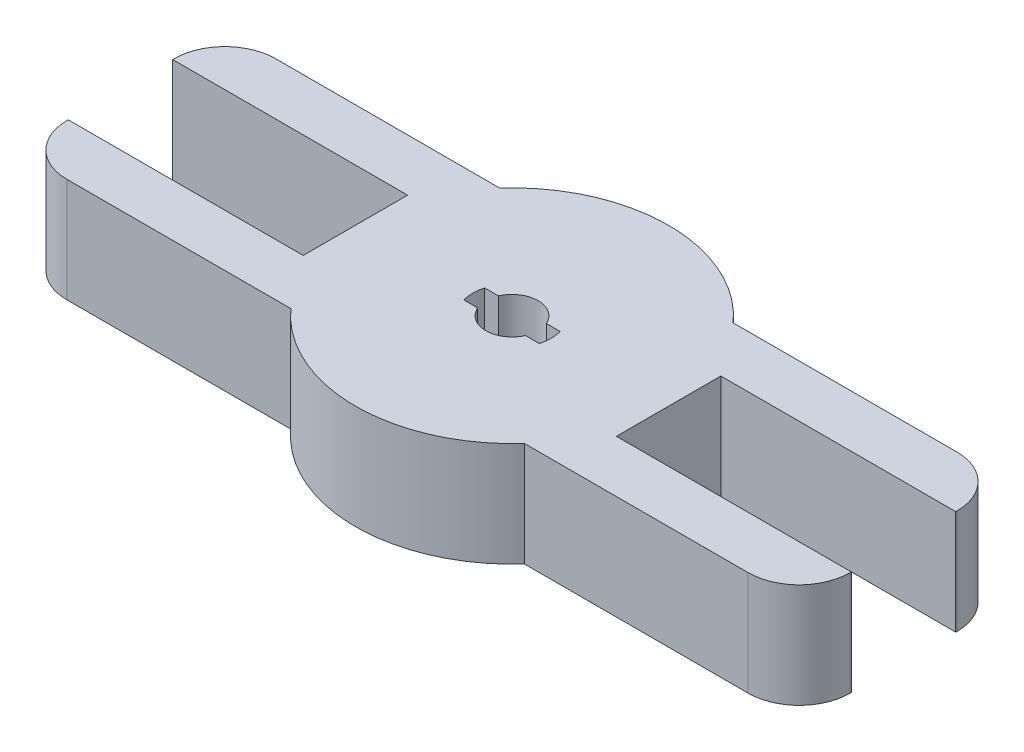
from build123d import *

# Parameters (mm, degrees)
BOSS_EXTRUDE1_DEPTH  = 20
SKETCH2_W            = 45
SKETCH2_H            = 20
CUT_EXTRUDE1_DEPTH   = 20
FILLET1_R            = 9.75
FILLET1_OF_MIRROR4_R = 9.75


with BuildPart() as part:
    # Sketch1 → Boss-Extrude1 (new body)
    with BuildSketch(Plane(origin=(0, 0, 0), x_dir=(1, 0, 0), z_dir=(0, 1, 0))):
        with BuildLine():
            Line((22.360679775, 20), (75, 20))
            Line((75, 20), (75, -20))
            Line((75, -20), (22.360679775, -20))
            ThreePointArc((22.360679775, -20), (12.247448714, -27.386127875), (0, -30))
            Line((0, -30), (0, -20))
            Line((0, -20), (0, 20))
            Line((0, 20), (0, 30))
            ThreePointArc((0, 30), (12.247448714, 27.386127875), (22.360679775, 20))
        make_face()
    boss_extrude1 = extrude(amount=BOSS_EXTRUDE1_DEPTH)

    # Sketch2 → Cut-Extrude1 (cut)
    with BuildSketch(Plane(origin=(0, 20, 0), x_dir=(1, 0, 0), z_dir=(0, 1, 0))):
        with BuildLine():
            Line((0, 5), (0, -5))
            ThreePointArc((0, -5), (2.738612788, -4.183300133), (4.582575695, -2))
            Line((4.582575695, -2), (7.228416147, -2))
            ThreePointArc((7.228416147, -2), (7.5, 0), (7.228416147, 2))
            Line((7.228416147, 2), (4.582575695, 2))
            ThreePointArc((4.582575695, 2), (2.738612788, 4.183300133), (0, 5))
        make_face()
        with Locations((52.5, 0)):
            Rectangle(SKETCH2_W, SKETCH2_H)
    cut_extrude1 = extrude(amount=-CUT_EXTRUDE1_DEPTH, mode=Mode.SUBTRACT)

    # Fillet1
    fillet1_edges = [part.edges().sort_by_distance(p)[0] for p in [
        (75, 10, -20),
        (75, 10, 20),
    ]]
    fillet(fillet1_edges, radius=FILLET1_R)

    # Mirror4: Boss-Extrude1, Cut-Extrude1 across plane
    add(boss_extrude1.mirror(Plane(origin=(0, 0, 0), x_dir=(0, 0, 1), z_dir=(1, 0, 0))))
    add(cut_extrude1.mirror(Plane(origin=(0, 0, 0), x_dir=(0, 0, 1), z_dir=(1, 0, 0))), mode=Mode.SUBTRACT)

    # Fillet1 of Mirror4
    fillet1_of_mirror4_edges = [part.edges().sort_by_distance(p)[0] for p in [
        (-75, 10, -20),
        (-75, 10, 20),
    ]]
    fillet(fillet1_of_mirror4_edges, radius=FILLET1_OF_MIRROR4_R)


solid = part.part
